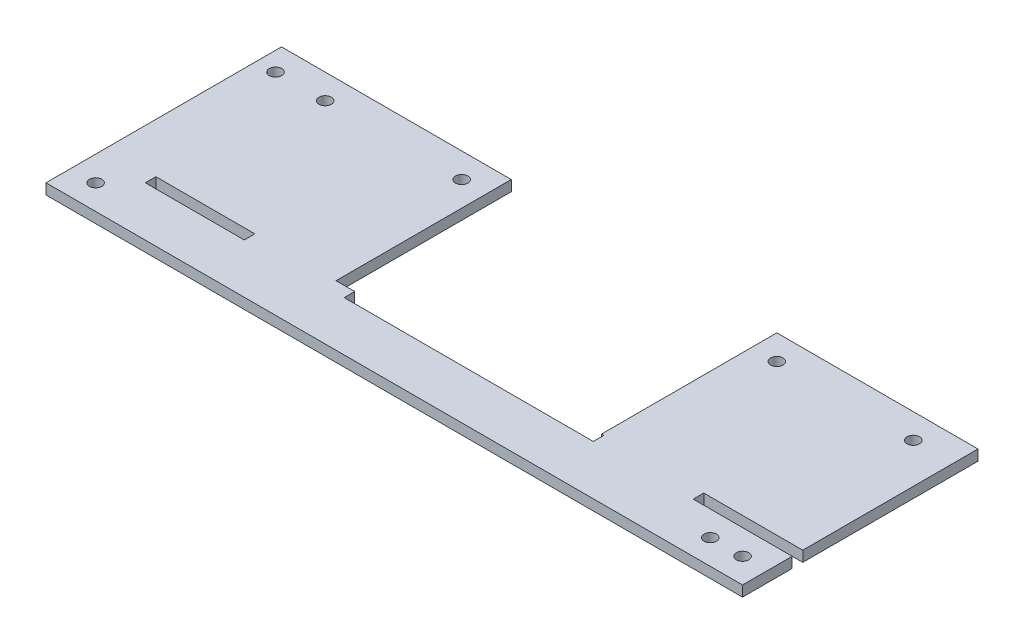
from build123d import *

# Parameters (mm, degrees)
SKETCH1_W           = 50.6476
SKETCH1_H           = 5.4102
SKETCH1_R           = 3.175
BOSS_EXTRUDE1_DEPTH = 5.4102


with BuildPart() as part:
    # Sketch1 → Boss-Extrude1 (new body)
    with BuildSketch(Plane(origin=(0, 0, 0), x_dir=(1, 0, 0), z_dir=(0, 1, 0))):
        Polygon((-190.881, 47.5361), (-190.881, -72.9361), (165.481, -72.9361), (165.481, -47.5361), (114.8334, -47.5361), (114.8334, -42.1259), (165.481, -42.1259), (165.481, 47.5361), (62.5475, 47.5361), (62.5475, -42.1259), (63.7286, -42.1259), (63.7286, -47.5361), (-63.7286, -47.5361), (-63.7286, -42.1259), (-73.30694, -42.1259), (-73.30694, 47.5361), align=None)
        with Locations((-140.1572, -44.831)):
            Rectangle(SKETCH1_W, SKETCH1_H, mode=Mode.SUBTRACT)
        with Locations(Location((-181.229, 34.8361, 0), (0, 0, 270))):
            Circle(SKETCH1_R, mode=Mode.SUBTRACT)
        with Locations(Location((152.781, -60.2361, 0), (0, 0, 270))):
            Circle(SKETCH1_R, mode=Mode.SUBTRACT)
        with Locations(Location((-178.181, -60.2361, 0), (0, 0, 270))):
            Circle(SKETCH1_R, mode=Mode.SUBTRACT)
        with Locations(Location((136.271, -60.2361, 0), (0, 0, 270))):
            Circle(SKETCH1_R, mode=Mode.SUBTRACT)
        with Locations(Location((-155.829, 34.8361, 0), (0, 0, 270))):
            Circle(SKETCH1_R, mode=Mode.SUBTRACT)
        with Locations(Location((-86.00694, 34.8361, 0), (0, 0, 270))):
            Circle(SKETCH1_R, mode=Mode.SUBTRACT)
        with Locations(Location((145.06956, 34.8361, 0), (0, 0, 270))):
            Circle(SKETCH1_R, mode=Mode.SUBTRACT)
        with Locations(Location((75.2475, 34.8361, 0), (0, 0, 270))):
            Circle(SKETCH1_R, mode=Mode.SUBTRACT)
    extrude(amount=BOSS_EXTRUDE1_DEPTH)


solid = part.part
